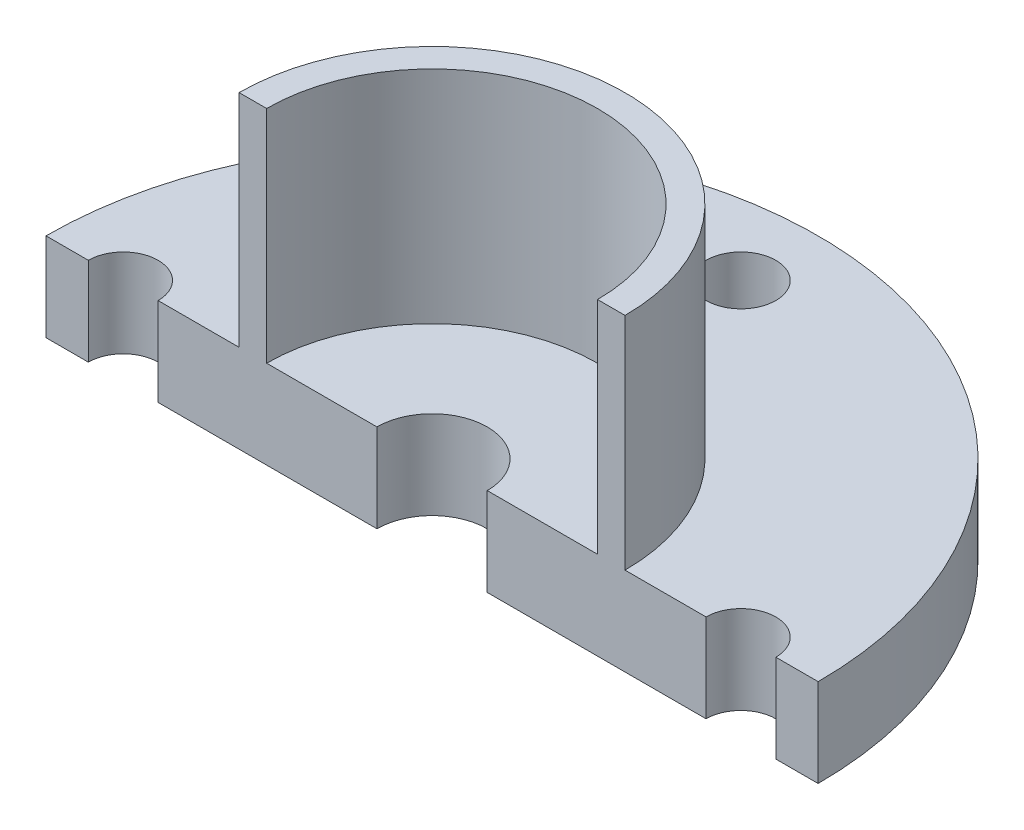
from build123d import *

# Parameters (mm, degrees)
ESQUISSE2_R             = 35
ESQUISSE2_R_2           = 5
ESQUISSE2_R_3           = 3.16227766
BASE_EXTRUSION_DEPTH    = 8
ESQUISSE3_R             = 17.492855685
ESQUISSE3_R_2           = 15
BOSS_EXTRU_1_DEPTH      = 20
ESQUISSE4_W             = 72
ESQUISSE4_H             = 33
ENL_V_MAT_EXTRU_2_DEPTH = 57.868268832


with BuildPart() as part:
    # Esquisse2 → Base-Extrusion (new body)
    with BuildSketch(Plane(origin=(0, 0, 0), x_dir=(1, 0, 0), z_dir=(0, 1, 0))):
        Circle(ESQUISSE2_R)
        Circle(ESQUISSE2_R_2, mode=Mode.SUBTRACT)
        with Locations((-28, 0)):
            Circle(ESQUISSE2_R_3, mode=Mode.SUBTRACT)
        with Locations(Location((0, 28, 0), (0, 0, 270))):
            Circle(ESQUISSE2_R_3, mode=Mode.SUBTRACT)
        with Locations((0, -28)):
            Circle(ESQUISSE2_R_3, mode=Mode.SUBTRACT)
        with Locations((28, 0)):
            Circle(ESQUISSE2_R_3, mode=Mode.SUBTRACT)
    extrude(amount=BASE_EXTRUSION_DEPTH)

    # Esquisse3 → Boss.-Extru.1 (add)
    with BuildSketch(Plane(origin=(0, 8, 0), x_dir=(-1, 0, 0), z_dir=(0, 1, 0))):
        Circle(ESQUISSE3_R)
        Circle(ESQUISSE3_R_2, mode=Mode.SUBTRACT)
    extrude(amount=BOSS_EXTRU_1_DEPTH)

    # Esquisse4 → Enlèv. mat.-Extru.2 (cut, through all)
    with BuildSketch(Plane(origin=(0, 0, 0), x_dir=(1, 0, 0), z_dir=(0, 1, 0))):
        with Locations((-1, -16.5)):
            Rectangle(ESQUISSE4_W, ESQUISSE4_H)
    extrude(amount=ENL_V_MAT_EXTRU_2_DEPTH, mode=Mode.SUBTRACT)


with BuildPart() as enl_v_mat_extru_2_kept_piece:
    # of the separate pieces the step leaves, the one the design keeps (enl_v_mat_extru_2_pieces_kept)
    add(part.part.solids().sort_by_distance((35, 0, 0))[0])


solid = enl_v_mat_extru_2_kept_piece.part
